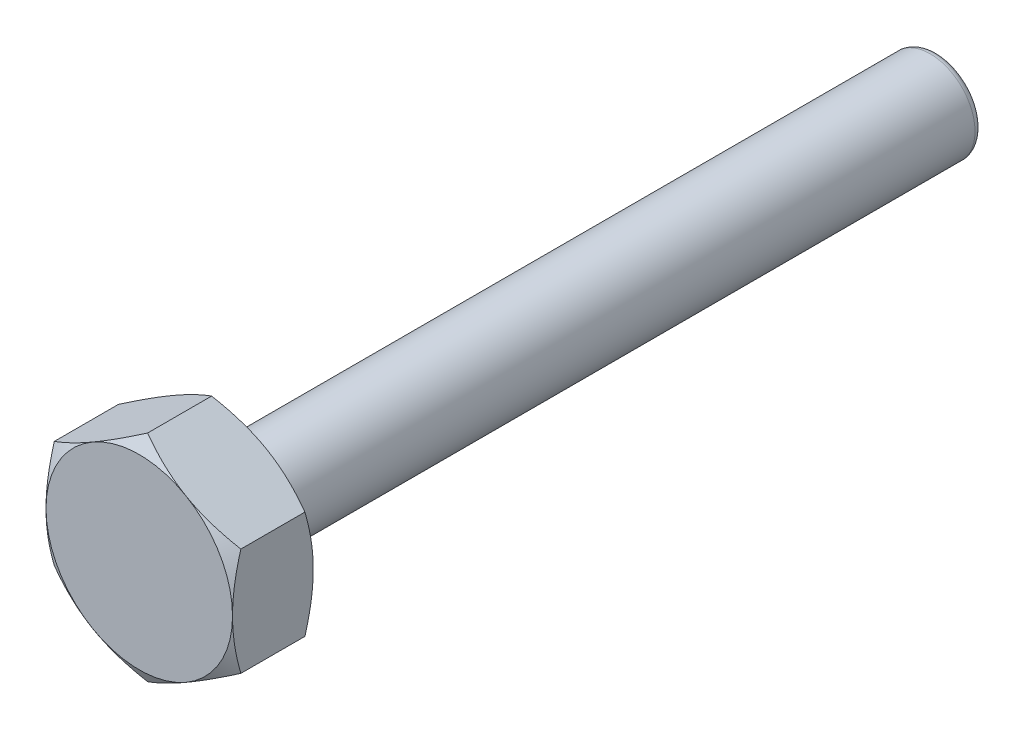
from build123d import *

# Parameters (mm, degrees)
BOSS_EXTRUDE1_DEPTH = 22.5
SKETCH2_OUTSIDE_W   = 294.908
SKETCH2_OUTSIDE_H   = 310.996
SKETCH2_OUTSIDE_R   = 52
CUT_EXTRUDE1_DEPTH  = 45
CUT_EXTRUDE1_DRAFT  = -60
SKETCH3_OUTSIDE_W   = 294.908
SKETCH3_OUTSIDE_H   = 310.996
SKETCH3_OUTSIDE_R   = 52
CUT_EXTRUDE2_DEPTH  = 45
CUT_EXTRUDE2_DRAFT  = -60
SKETCH4_R           = 25
BOSS_EXTRUDE2_DEPTH = 400
FILLET1_R           = 4


with BuildPart() as part:
    # Sketch1 → Boss-Extrude1 (new, symmetric)
    with BuildSketch(Plane.XY):
        Polygon((52, 30.022213998), (0, 60.044427996), (-52, 30.022213998), (-52, -30.022213998), (0, -60.044427996), (52, -30.022213998), align=None)
    extrude(amount=BOSS_EXTRUDE1_DEPTH, both=True)


with BuildPart() as cut_extrude1_tool:
    # Sketch2 outside → Cut-Extrude1 (with draft: the straight prism first)
    with BuildSketch(Plane.XY.offset(22.5)):
        Rectangle(SKETCH2_OUTSIDE_W, SKETCH2_OUTSIDE_H)
        Circle(SKETCH2_OUTSIDE_R, mode=Mode.SUBTRACT)
    extrude(amount=-CUT_EXTRUDE1_DEPTH)
    # Cut-Extrude1: the draft: its side faces are tilted about the plane it starts from
    cut_extrude1_sides = [cut_extrude1_tool.faces().sort_by_distance(p)[0] for p in [
        (0, -155.498, 0),
        (147.454, 0, 0),
        (0, 155.498, 0),
        (-147.454, 0, 0),
        (-52, 0, 0),
    ]]
    draft(cut_extrude1_sides, Plane.XY.offset(22.5), CUT_EXTRUDE1_DRAFT)


with BuildPart() as part_1:
    add(part.part)

    # Cut-Extrude1: cut by cut_extrude1_tool
    add(cut_extrude1_tool.part, mode=Mode.SUBTRACT)


with BuildPart() as cut_extrude2_tool:
    # Sketch3 outside → Cut-Extrude2 (with draft: the straight prism first)
    with BuildSketch(Plane(origin=(0, 0, -22.5), x_dir=(-1, 0, 0), z_dir=(0, 0, -1))):
        Rectangle(SKETCH3_OUTSIDE_W, SKETCH3_OUTSIDE_H)
        Circle(SKETCH3_OUTSIDE_R, mode=Mode.SUBTRACT)
    extrude(amount=-CUT_EXTRUDE2_DEPTH)
    # Cut-Extrude2: the draft: its side faces are tilted about the plane it starts from
    cut_extrude2_sides = [cut_extrude2_tool.faces().sort_by_distance(p)[0] for p in [
        (0, -155.498, 0),
        (-147.454, 0, 0),
        (0, 155.498, 0),
        (147.454, 0, 0),
        (52, 0, 0),
    ]]
    draft(cut_extrude2_sides, Plane(origin=(0, 0, -22.5), x_dir=(-1, 0, 0), z_dir=(0, 0, -1)), CUT_EXTRUDE2_DRAFT)


with BuildPart() as part_2:
    add(part_1.part)

    # Cut-Extrude2: cut by cut_extrude2_tool
    add(cut_extrude2_tool.part, mode=Mode.SUBTRACT)

    # Sketch4 → Boss-Extrude2 (add)
    with BuildSketch(Plane(origin=(0, 0, -22.5), x_dir=(-1, 0, 0), z_dir=(0, 0, -1))):
        with Locations(Location((0, 0, 0), (0, 0, 180))):
            Circle(SKETCH4_R)
    extrude(amount=BOSS_EXTRUDE2_DEPTH)

    # Fillet1
    fillet1_edges = [part_2.edges().sort_by_distance(p)[0] for p in [
        (-25, 0, -422.5),
    ]]
    fillet(fillet1_edges, radius=FILLET1_R)


solid = part_2.part
